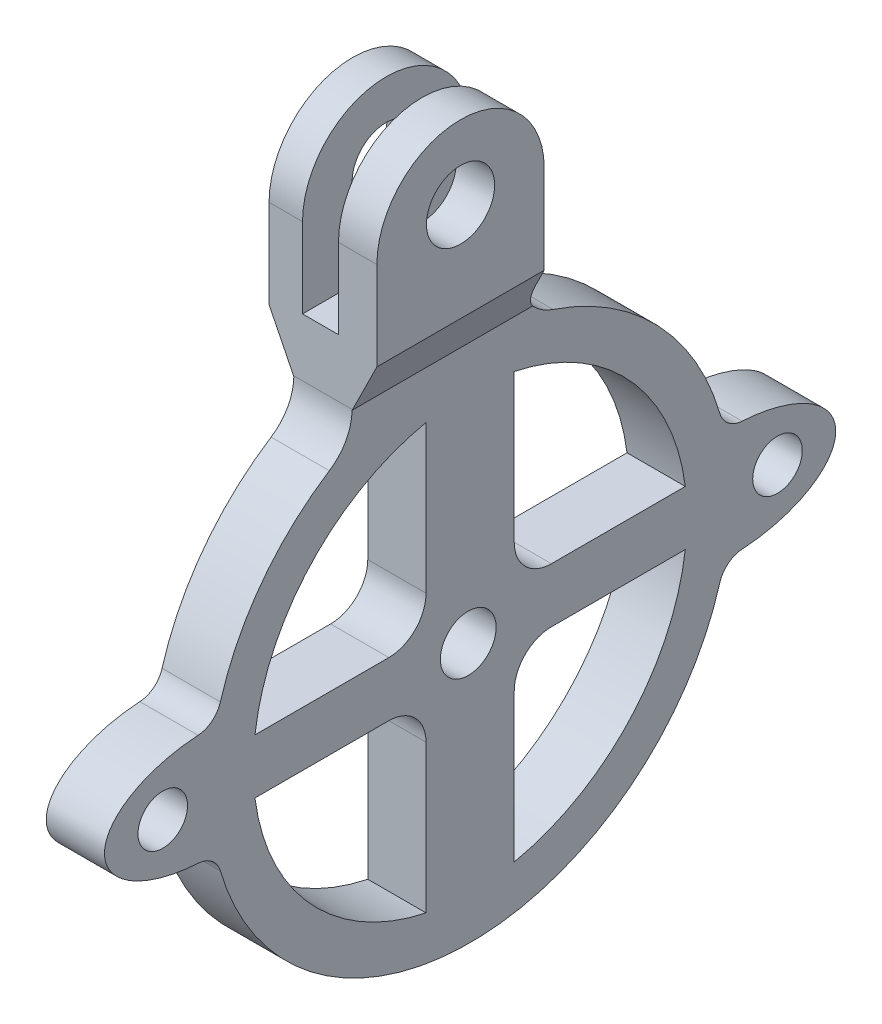
from build123d import *

# Parameters (mm, degrees)
SKETCH_1_R           = 2
SKETCH_1_R_2         = 2.75
SKETCH_1_R_3         = 2.25
EXTRUDE_2_DEPTH      = 8.7
SKETCH_8_W           = 2.9
SKETCH_8_H           = 13.2
CUT_EXTRUDE_11_DEPTH = 30


with BuildPart() as part:
    # 草图1 → 凸台-拉伸2 (new body)
    with BuildSketch(Plane(origin=(0, 0, 0), x_dir=(0, 0, -1), z_dir=(1, 0, 0))):
        with BuildLine():
            Line((-9.523168661, 32.152331174), (-9.523168661, 21.026742719))
            ThreePointArc((-9.523168661, 21.026742719), (-10.012126939, 19.110343484), (-11.359461675, 17.662463884))
            ThreePointArc((-11.359461675, 17.662463884), (-16.816854056, 12.577496557), (-20.152500023, 5.905653461))
            ThreePointArc((-20.152500023, 5.905653461), (-20.825612762, 4.903790761), (-21.9525847, 4.47165203))
            add(Edge.make_bspline(
                [(-21.9525847, 4.47165203), (-29.5, 4.021021071), (-29.5, 0), (-29.5, -4.021021071), (-21.9525847, -4.47165203)],
                knots=[4.824693691, 4.824693691, 4.824693691, 6.283185307, 6.283185307, 7.741676924, 7.741676924, 7.741676924], degree=2, weights=[1, 0.745677138, 1, 0.745677138, 1]))
            ThreePointArc((-21.9525847, -4.47165203), (-20.825612762, -4.903790761), (-20.152500023, -5.905653461))
            ThreePointArc((-20.152500023, -5.905653461), (2.6e-08, -21), (20.152500038, -5.905653412))
            ThreePointArc((20.152500038, -5.905653412), (20.825612688, -4.903790778), (21.95258449, -4.47165199))
            add(Edge.make_bspline(
                [(21.95258449, -4.47165199), (29.499998011, -4.021020278), (29.499998011, 0), (29.499998011, 4.021020278), (21.95258449, 4.47165199)],
                knots=[1.683101248, 1.683101248, 1.683101248, 3.141592654, 3.141592654, 4.600084059, 4.600084059, 4.600084059], degree=2, weights=[1, 0.745677208, 1, 0.745677208, 1]))
            ThreePointArc((21.95258449, 4.47165199), (20.825612688, 4.903790778), (20.152500038, 5.905653412))
            ThreePointArc((20.152500038, 5.905653412), (15.140943314, 14.551695282), (6.700538325, 19.902331174))
            ThreePointArc((6.700538325, 19.902331174), (4.728356924, 21.359281824), (3.976831339, 23.693251398))
            Line((3.976831339, 23.693251398), (3.976831339, 32.152331174))
            ThreePointArc((3.976831339, 32.152331174), (-2.773168661, 38.902331174), (-9.523168661, 32.152331174))
        make_face()
        with Locations((-24.8, 0)):
            Circle(SKETCH_1_R, mode=Mode.SUBTRACT)
        with Locations(Location((24.8, 0, 0), (0, 0, 180))):
            Circle(SKETCH_1_R, mode=Mode.SUBTRACT)
        with Locations((-2.773168661, 32.952331174)):
            Circle(SKETCH_1_R_2, mode=Mode.SUBTRACT)
        with Locations((-0.15, 0)):
            Circle(SKETCH_1_R_3, mode=Mode.SUBTRACT)
        with BuildLine():
            Line((-3.558339237, 17.134416298), (-3.558339237, 5.205042955))
            ThreePointArc((-3.558339237, 5.205042955), (-4.437018893, 3.083722611), (-6.558339237, 2.205042955))
            Line((-6.558339237, 2.205042955), (-17.36052377, 2.205042955))
            ThreePointArc((-17.36052377, 2.205042955), (-12.849951536, 11.879762014), (-3.558339237, 17.134416298))
        make_face(mode=Mode.SUBTRACT)
        with BuildLine():
            Line((3.558339237, -17.134416298), (3.558339237, -5.205042955))
            ThreePointArc((3.558339237, -5.205042955), (4.437018893, -3.083722611), (6.558339237, -2.205042955))
            Line((6.558339237, -2.205042955), (17.36052377, -2.205042955))
            ThreePointArc((17.36052377, -2.205042955), (12.849951536, -11.879762014), (3.558339237, -17.134416298))
        make_face(mode=Mode.SUBTRACT)
        with BuildLine():
            Line((17.36052377, 2.205042955), (6.558339237, 2.205042955))
            ThreePointArc((6.558339237, 2.205042955), (4.437018893, 3.083722611), (3.558339237, 5.205042955))
            Line((3.558339237, 5.205042955), (3.558339237, 17.134416298))
            ThreePointArc((3.558339237, 17.134416298), (12.849951536, 11.879762014), (17.36052377, 2.205042955))
        make_face(mode=Mode.SUBTRACT)
        with BuildLine():
            Line((-17.36052377, -2.205042955), (-6.558339237, -2.205042955))
            ThreePointArc((-6.558339237, -2.205042955), (-4.437018893, -3.083722611), (-3.558339237, -5.205042955))
            Line((-3.558339237, -5.205042955), (-3.558339237, -17.134416298))
            ThreePointArc((-3.558339237, -17.134416298), (-12.849951536, -11.879762014), (-17.36052377, -2.205042955))
        make_face(mode=Mode.SUBTRACT)
    extrude(amount=EXTRUDE_2_DEPTH)

    # 草图8 → 切除-拉伸11 (cut, symmetric)
    with BuildSketch(Plane.XY):
        Polygon((0, -21), (2, -21), (2, 20.968871126), (0, 25), align=None)
        Polygon((8.7, -21), (6.7, -21), (6.7, 20.968871126), (8.7, 25), align=None)
        with Locations((4.15, 32.302331174)):
            Rectangle(SKETCH_8_W, SKETCH_8_H)
    extrude(amount=CUT_EXTRUDE_11_DEPTH, both=True, mode=Mode.SUBTRACT)


solid = part.part
